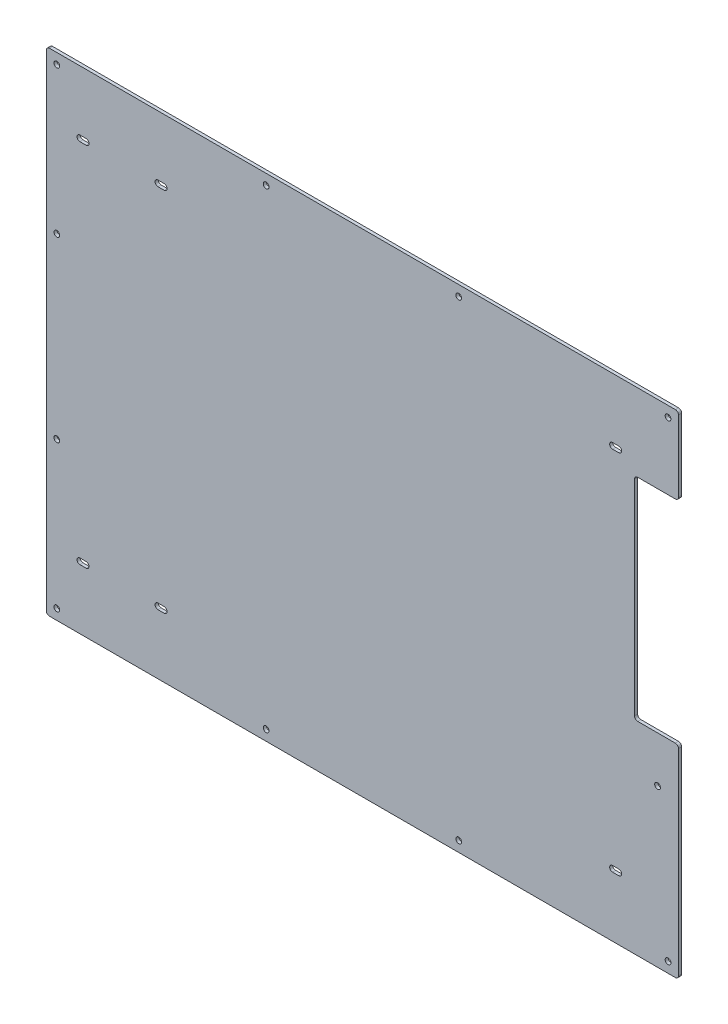
from build123d import *

# Parameters (mm, degrees)
SKETCH1_W                         = 604
SKETCH1_H                         = 470
BOSS_EXTRUDE1_DEPTH               = 3
FILLET1_R                         = 3
M5_CLEARANCE_HOLE1_D              = 5.5
M5_MANUFACTURING_FIXTURING_HOLE_D = 5.5
CUT_EXTRUDE5_DEPTH                = 766.326727614
SKETCH6_W                         = 42
SKETCH6_H                         = 202
CUT_EXTRUDE2_DEPTH                = 766.326727614
FILLET3_R                         = 3


with BuildPart() as part:
    # Sketch1 → Boss-Extrude1 (new body)
    with BuildSketch(Plane.XY):
        with Locations((302, 235)):
            Rectangle(SKETCH1_W, SKETCH1_H)
    extrude(amount=BOSS_EXTRUDE1_DEPTH)

    # Fillet1
    fillet1_edges = [part.edges().sort_by_distance(p)[0] for p in [
        (0, 470, 1.5),
        (604, 470, 1.5),
        (604, 0, 1.5),
        (0, 0, 1.5),
    ]]
    fillet(fillet1_edges, radius=FILLET1_R)

    # M5 Clearance Hole1 (through all)
    with Locations(Plane(origin=(0, 0, 0), x_dir=(-1, 0, 0), z_dir=(0, 0, -1))):
        with Locations((-594, 460), (-394, 460), (-210, 460), (-10, 460), (-10, 10), (-210, 10), (-394, 10), (-594, 10), (-544, 410), (-544, 60), (-35, 410), (-35, 60), (-109.625, 410), (-109.625, 60)):
            Hole(M5_CLEARANCE_HOLE1_D / 2)

    # M5 Manufacturing Fixturing Hole (through all)
    with Locations(Plane.XY.offset(3)):
        with Locations((10, 320), (10, 150), (584, 320), (584, 150)):
            Hole(M5_MANUFACTURING_FIXTURING_HOLE_D / 2)

    # Sketch9 → Cut-Extrude5 (cut, through all)
    with BuildSketch(Plane.XY.offset(3)):
        with BuildLine():
            Line((32, 412.75), (38, 412.75))
            ThreePointArc((38, 412.75), (40.75, 410), (38, 407.25))
            Line((38, 407.25), (32, 407.25))
            ThreePointArc((32, 407.25), (29.25, 410), (32, 412.75))
        make_face()
        with BuildLine():
            Line((106.625, 412.75), (112.625, 412.75))
            ThreePointArc((112.625, 412.75), (115.375, 410), (112.625, 407.25))
            Line((112.625, 407.25), (106.625, 407.25))
            ThreePointArc((106.625, 407.25), (103.875, 410), (106.625, 412.75))
        make_face()
        with BuildLine():
            Line((32, 62.75), (38, 62.75))
            ThreePointArc((38, 62.75), (40.75, 60), (38, 57.25))
            Line((38, 57.25), (32, 57.25))
            ThreePointArc((32, 57.25), (29.25, 60), (32, 62.75))
        make_face()
        with BuildLine():
            Line((106.625, 62.75), (112.625, 62.75))
            ThreePointArc((112.625, 62.75), (115.375, 60), (112.625, 57.25))
            Line((112.625, 57.25), (106.625, 57.25))
            ThreePointArc((106.625, 57.25), (103.875, 60), (106.625, 62.75))
        make_face()
        with BuildLine():
            Line((541, 412.75), (547, 412.75))
            ThreePointArc((547, 412.75), (549.75, 410), (547, 407.25))
            Line((547, 407.25), (541, 407.25))
            ThreePointArc((541, 407.25), (538.25, 410), (541, 412.75))
        make_face()
        with BuildLine():
            Line((541, 62.75), (547, 62.75))
            ThreePointArc((547, 62.75), (549.75, 60), (547, 57.25))
            Line((547, 57.25), (541, 57.25))
            ThreePointArc((541, 57.25), (538.25, 60), (541, 62.75))
        make_face()
    extrude(amount=-CUT_EXTRUDE5_DEPTH, mode=Mode.SUBTRACT)

    # Sketch6 → Cut-Extrude2 (cut, through all)
    with BuildSketch(Plane.XY.offset(3)):
        with Locations((583, 295)):
            Rectangle(SKETCH6_W, SKETCH6_H)
    extrude(amount=-CUT_EXTRUDE2_DEPTH, mode=Mode.SUBTRACT)

    # Fillet3
    fillet3_edges = [part.edges().sort_by_distance(p)[0] for p in [
        (604, 396, 1.5),
        (604, 194, 1.5),
        (562, 194, 1.5),
        (562, 396, 1.5),
    ]]
    fillet(fillet3_edges, radius=FILLET3_R)


solid = part.part
